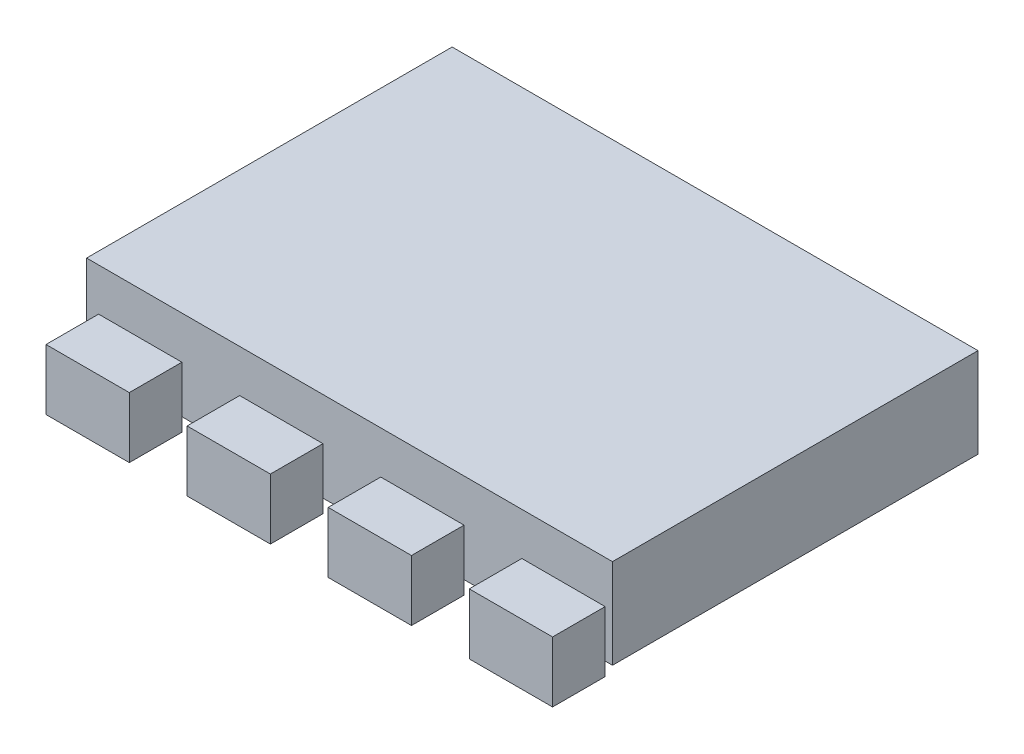
from build123d import *

# Parameters (mm, degrees)
SKETCH_1_W             = 82
SKETCH_1_H             = 57
EXTRUDE_1_DEPTH        = 14
SKETCH_2_W             = 12.989846737
SKETCH_2_H             = 9.461740216
EXTRUDE_2_DEPTH        = 8.2
PATTERN_LINEAR_1_COUNT = 4
PATTERN_LINEAR_1_PITCH = 22


with BuildPart() as part:
    # 草图1 → 凸台-拉伸1 (new body)
    with BuildSketch(Plane(origin=(0, 0, 0), x_dir=(1, 0, 0), z_dir=(0, 1, 0))):
        Rectangle(SKETCH_1_W, SKETCH_1_H)
    extrude(amount=EXTRUDE_1_DEPTH)

    # 草图2 → 凸台-拉伸2 (add)
    with BuildSketch(Plane.XY.offset(28.5)):
        with Locations((-32.634985321, 2.629958968)):
            Rectangle(SKETCH_2_W, SKETCH_2_H)
    extrude_2 = extrude(amount=EXTRUDE_2_DEPTH)

    # 阵列(线性)1: 凸台-拉伸2 ×4
    with Locations(*[(i * PATTERN_LINEAR_1_PITCH, 0, 0) for i in range(1, PATTERN_LINEAR_1_COUNT)]):
        add(extrude_2)


solid = part.part
